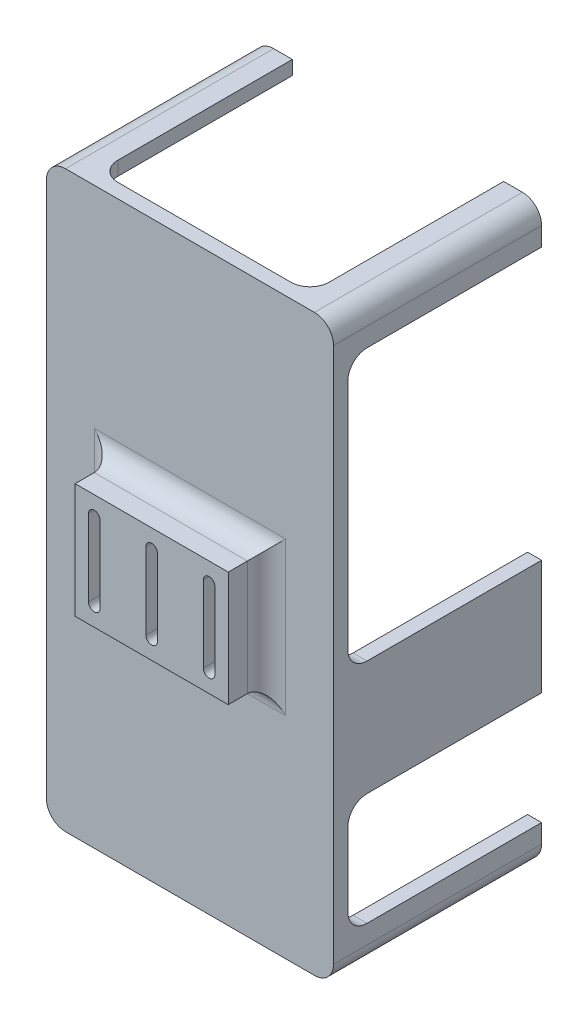
from build123d import *

# Parameters (mm, degrees)
SKETCH2_W                 = 150
SKETCH2_H                 = 300
BOXPLATFORM_DEPTH         = 7.5
SKETCH3_W                 = 80
SKETCH3_H                 = 60
EXTRUSIONCONNECTION_DEPTH = 20
FILLET1_R                 = 10
MOUNTSLOTS_DEPTH          = 444.962367113
WASHERSLOTS_DEPTH         = 20
SKETCH7_W                 = 7.3
SKETCH7_H                 = 60
WALLS_DEPTH               = 101.2
FILLET2_R                 = 10
FILLET3_R                 = 10
SKETCH8_R                 = 2
M3X7MMHOLES_DEPTH         = 8


with BuildPart() as part:
    # Sketch2 → BoxPlatform (new body)
    with BuildSketch(Plane.XY):
        with Locations((-9.387993296, -285)):
            Rectangle(SKETCH2_W, SKETCH2_H)
    extrude(amount=BOXPLATFORM_DEPTH)

    # Sketch3 → ExtrusionConnection (add)
    with BuildSketch(Plane.XY.offset(7.5)):
        with Locations((-9.387993296, -285)):
            Rectangle(SKETCH3_W, SKETCH3_H)
    extrude(amount=EXTRUSIONCONNECTION_DEPTH)

    # Fillet1
    fillet1_edges = [part.edges().sort_by_distance(p)[0] for p in [
        (-9.387993296, -315, 7.5),
        (30.612006704, -285, 7.5),
        (-9.387993296, -255, 7.5),
        (-49.387993296, -285, 7.5),
    ]]
    fillet(fillet1_edges, radius=FILLET1_R)

    # Sketch5 → MountSlots (cut, through all)
    with BuildSketch(Plane.XY.offset(27.5)):
        with BuildLine():
            Line((17.612006704, -305), (17.612006704, -265))
            ThreePointArc((17.612006704, -265), (20.612006704, -262), (23.612006704, -265))
            Line((23.612006704, -265), (23.612006704, -305))
            ThreePointArc((23.612006704, -305), (20.612006704, -308), (17.612006704, -305))
        make_face()
        with BuildLine():
            Line((-42.387993296, -305), (-42.387993296, -265))
            ThreePointArc((-42.387993296, -265), (-39.387993296, -262), (-36.387993296, -265))
            Line((-36.387993296, -265), (-36.387993296, -305))
            ThreePointArc((-36.387993296, -305), (-39.387993296, -308), (-42.387993296, -305))
        make_face()
        with BuildLine():
            Line((-12.387993296, -305), (-12.387993296, -265))
            ThreePointArc((-12.387993296, -265), (-9.387993296, -262), (-6.387993296, -265))
            Line((-6.387993296, -265), (-6.387993296, -305))
            ThreePointArc((-6.387993296, -305), (-9.387993296, -308), (-12.387993296, -305))
        make_face()
    extrude(amount=-MOUNTSLOTS_DEPTH, mode=Mode.SUBTRACT)

    # Sketch6 → WasherSlots (cut)
    with BuildSketch(Plane(origin=(0, 0, 0), x_dir=(-1, 0, 0), z_dir=(0, 0, -1))):
        with BuildLine():
            Line((-15.612006704, -265), (-15.612006704, -305))
            ThreePointArc((-15.612006704, -305), (-20.612006704, -310), (-25.612006704, -305))
            Line((-25.612006704, -305), (-25.612006704, -265))
            ThreePointArc((-25.612006704, -265), (-20.612006704, -260), (-15.612006704, -265))
        make_face()
        with BuildLine():
            Line((14.387993296, -265), (14.387993296, -305))
            ThreePointArc((14.387993296, -305), (9.387993296, -310), (4.387993296, -305))
            Line((4.387993296, -305), (4.387993296, -265))
            ThreePointArc((4.387993296, -265), (9.387993296, -260), (14.387993296, -265))
        make_face()
        with BuildLine():
            Line((44.387993296, -265), (44.387993296, -305))
            ThreePointArc((44.387993296, -305), (39.387993296, -310), (34.387993296, -305))
            Line((34.387993296, -305), (34.387993296, -265))
            ThreePointArc((34.387993296, -265), (39.387993296, -260), (44.387993296, -265))
        make_face()
    extrude(amount=-WASHERSLOTS_DEPTH, mode=Mode.SUBTRACT)

    # Sketch7 → Walls (add)
    with BuildSketch(Plane(origin=(0, 0, 0), x_dir=(-1, 0, 0), z_dir=(0, 0, -1))):
        Polygon((64.587993296, -135), (84.387993296, -135), (84.387993296, -154.8), (77.087993296, -154.8), (77.087993296, -142.3), (64.587993296, -142.3), align=None)
        Polygon((84.387993296, -435), (84.387993296, -415.2), (77.087993296, -415.2), (77.087993296, -427.7), (64.587993296, -427.7), (64.587993296, -435), align=None)
        Polygon((-45.812006704, -142.3), (-58.312006704, -142.3), (-58.312006704, -154.8), (-65.612006704, -154.8), (-65.612006704, -135), (-45.812006704, -135), align=None)
        Polygon((-65.612006704, -435), (-65.612006704, -415.2), (-58.312006704, -415.2), (-58.312006704, -427.7), (-45.812006704, -427.7), (-45.812006704, -435), align=None)
        with Locations((-61.962006704, -326.5)):
            Rectangle(SKETCH7_W, SKETCH7_H)
        with Locations((80.737993296, -326.5)):
            Rectangle(SKETCH7_W, SKETCH7_H)
    extrude(amount=WALLS_DEPTH)

    # Fillet2
    fillet2_edges = [part.edges().sort_by_distance(p)[0] for p in [
        (65.612006704, -435, -46.85),
        (-84.387993296, -435, -46.85),
        (-84.387993296, -135, -46.85),
        (65.612006704, -135, -46.85),
    ]]
    fillet(fillet2_edges, radius=FILLET2_R)

    # Fillet3
    fillet3_edges = [part.edges().sort_by_distance(p)[0] for p in [
        (-64.587993296, -138.65, 0),
        (-80.737993296, -154.8, 0),
        (-80.737993296, -415.2, 0),
        (-64.587993296, -431.35, 0),
        (61.962006704, -154.8, 0),
        (45.812006704, -138.65, 0),
        (61.962006704, -415.2, 0),
        (45.812006704, -431.35, 0),
        (61.962006704, -356.5, 0),
        (61.962006704, -296.5, 0),
        (-80.737993296, -296.5, 0),
        (-80.737993296, -356.5, 0),
    ]]
    fillet(fillet3_edges, radius=FILLET3_R)

    # Sketch8 → M3x7mmHoles (cut)
    with BuildSketch(Plane(origin=(0, 0, -101.2), x_dir=(-1, 0, 0), z_dir=(0, 0, -1))):
        with Locations((80.887993296, -147.8)):
            Circle(SKETCH8_R)
        with Locations((-61.812006704, -147.8)):
            Circle(SKETCH8_R)
        with Locations((80.887993296, -326.5)):
            Circle(SKETCH8_R)
        with Locations((-61.812006704, -326.5)):
            Circle(SKETCH8_R)
        with Locations((80.887993296, -422.2)):
            Circle(SKETCH8_R)
        with Locations((-61.812006704, -422.2)):
            Circle(SKETCH8_R)
    extrude(amount=-M3X7MMHOLES_DEPTH, mode=Mode.SUBTRACT)


solid = part.part
